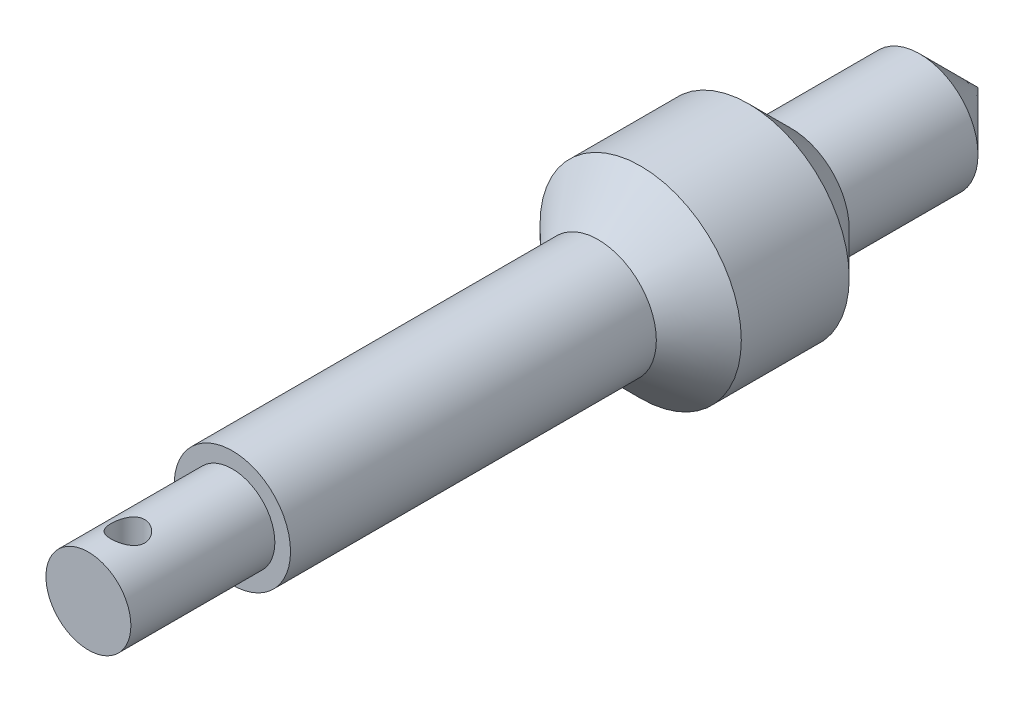
from build123d import *

# Parameters (mm, degrees)
CUT_EXTRUDE1_DEPTH      = 33.624799251
CUT_EXTRUDE1_DEPTH_BACK = 33.624799251


with BuildPart() as part:
    # Sketch1 → Revolve2 (revolve)
    with BuildSketch(Plane(origin=(0, 0, 0), x_dir=(0, 0, -1), z_dir=(1, 0, 0)), mode=Mode.PRIVATE) as revolve2_sk:
        Polygon((31.929374814, 0), (29.191874814, 2.7375), (23.128374876, 2.7375), (21.128124876, 4.73775), (16.048124876, 4.73775), (14.047874876, 2.7375), (-3.175, 2.7375), (-3.175, 2.000000064), (-9.953125128, 2.000000064), (-9.953125128, 0), align=None)
    revolve(revolve2_sk.sketch.rotate(Axis((0, 0, 0), (0, 0, -1)), 90), axis=Axis((0, 0, 0), (0, 0, -1)))

    # Sketch2 → Cut-Extrude1 (cut, two sides: drawn at the far end of the back side and taken through both)
    with BuildSketch(Plane(origin=(0, 0, 0), x_dir=(1, 0, 0), z_dir=(0, 1, 0)).offset(-CUT_EXTRUDE1_DEPTH_BACK)):
        with BuildLine():
            ThreePointArc((0.79375, -8.095750128), (0.561266008, -7.53448412), (0, -7.302000128))
            Line((0, -7.302000128), (0, -8.889500128))
            ThreePointArc((0, -8.889500128), (0.561266008, -8.657016136), (0.79375, -8.095750128))
        make_face()
        with BuildLine():
            Line((0, -8.889500128), (0, -7.302000128))
            ThreePointArc((0, -7.302000128), (-0.79375, -8.095750128), (0, -8.889500128))
        make_face()
        with BuildLine():
            ThreePointArc((0.79375, -8.095750128), (0.561266008, -7.53448412), (0, -7.302000128))
            Line((0, -7.302000128), (0, -8.889500128))
            ThreePointArc((0, -8.889500128), (0.561266008, -8.657016136), (0.79375, -8.095750128))
        make_face()
        with BuildLine():
            Line((0, -8.889500128), (0, -7.302000128))
            ThreePointArc((0, -7.302000128), (-0.79375, -8.095750128), (0, -8.889500128))
        make_face()
    extrude(amount=CUT_EXTRUDE1_DEPTH + CUT_EXTRUDE1_DEPTH_BACK, mode=Mode.SUBTRACT)


solid = part.part
